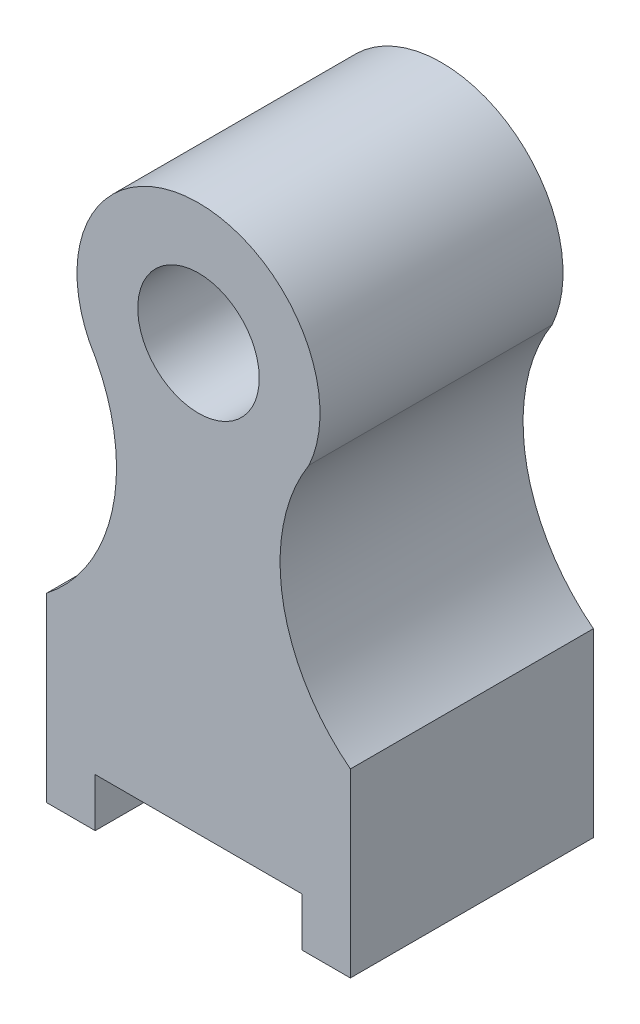
from build123d import *

# Parameters (mm, degrees)
SKETCH1_R           = 25.4
BOSS_EXTRUDE1_DEPTH = 101.6


with BuildPart() as part:
    # Sketch1 → Boss-Extrude1 (new body)
    with BuildSketch(Plane.XY):
        with BuildLine():
            Line((43.18, -177.8), (43.18, -198.12))
            Line((43.18, -198.12), (63.5, -198.12))
            Line((63.5, -198.12), (63.5, -122.435433935))
            ThreePointArc((63.5, -122.435433935), (36.049391603, -79.421078062), (41.89548787, -28.729916397))
            ThreePointArc((41.89548787, -28.729916397), (43.95358505, -24.826361045), (46.234198191, -21.048489675))
            ThreePointArc((46.234198191, -21.048489675), (-0.610127533, 50.796335935), (-45.715295245, -22.152918107))
            ThreePointArc((-45.715295245, -22.152918107), (-44.106525914, -24.87240035), (-42.611881246, -27.65623938))
            ThreePointArc((-42.611881246, -27.65623938), (-36.071200921, -78.724738597), (-63.5, -122.295750663))
            Line((-63.5, -122.295750663), (-63.5, -198.12))
            Line((-63.5, -198.12), (-43.18, -198.12))
            Line((-43.18, -198.12), (-43.18, -177.8))
            Line((-43.18, -177.8), (43.18, -177.8))
        make_face()
        Circle(SKETCH1_R, mode=Mode.SUBTRACT)
    extrude(amount=BOSS_EXTRUDE1_DEPTH)


solid = part.part
